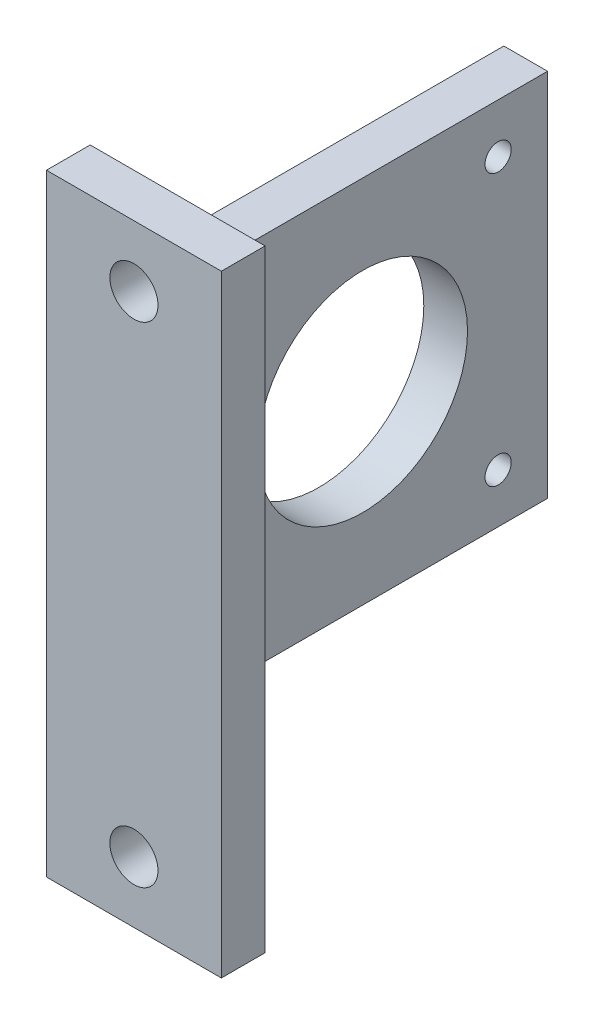
from build123d import *

# Parameters (mm, degrees)
SKETCH2_W           = 42.3
SKETCH2_H           = 42.3
SKETCH2_R           = 1.5
SKETCH2_R_2         = 12
BOSS_EXTRUDE1_DEPTH = 5
SKETCH5_W           = 5
SKETCH5_H           = 42.3
BOSS_EXTRUDE3_DEPTH = 5
SKETCH3_W           = 20
SKETCH3_H           = 70
SKETCH3_R           = 2.75
BOSS_EXTRUDE2_DEPTH = 5
FILLET1_R           = 4


with BuildPart() as part:
    # Sketch2 → Boss-Extrude1 (new body)
    with BuildSketch(Plane(origin=(0, 0, 0), x_dir=(0, 0, -1), z_dir=(1, 0, 0))):
        Rectangle(SKETCH2_W, SKETCH2_H)
        with Locations((-15.5, 15.5)):
            Circle(SKETCH2_R, mode=Mode.SUBTRACT)
        with Locations((15.5, 15.5)):
            Circle(SKETCH2_R, mode=Mode.SUBTRACT)
        with Locations((15.5, -15.5)):
            Circle(SKETCH2_R, mode=Mode.SUBTRACT)
        with Locations((-15.5, -15.5)):
            Circle(SKETCH2_R, mode=Mode.SUBTRACT)
        Circle(SKETCH2_R_2, mode=Mode.SUBTRACT)
    extrude(amount=BOSS_EXTRUDE1_DEPTH)

    # Sketch5 → Boss-Extrude3 (add)
    with BuildSketch(Plane.XY.offset(21.15)):
        with Locations((2.5, 0)):
            Rectangle(SKETCH5_W, SKETCH5_H)
    extrude(amount=BOSS_EXTRUDE3_DEPTH)

    # Sketch3 → Boss-Extrude2 (add)
    with BuildSketch(Plane.XY.offset(26.15)):
        with Locations((10, 0)):
            Rectangle(SKETCH3_W, SKETCH3_H)
        with Locations((10, 28)):
            Circle(SKETCH3_R, mode=Mode.SUBTRACT)
        with Locations((10, -28)):
            Circle(SKETCH3_R, mode=Mode.SUBTRACT)
    extrude(amount=BOSS_EXTRUDE2_DEPTH)

    # Fillet1
    fillet1_edges = [part.edges().sort_by_distance(p)[0] for p in [
        (2.5, -21.15, 26.15),
        (2.5, 21.15, 26.15),
    ]]
    fillet(fillet1_edges, radius=FILLET1_R)


solid = part.part
